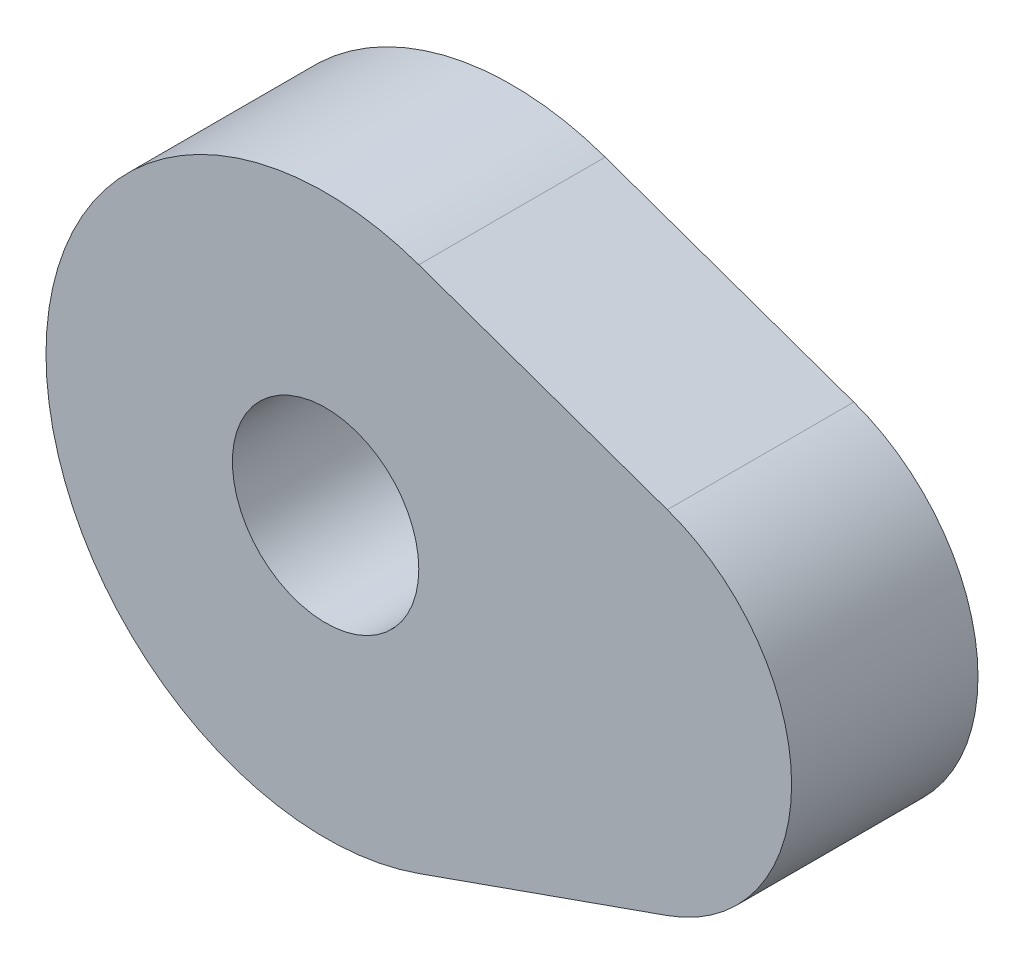
from build123d import *

# Parameters (mm, degrees)
EXTRUDE_1_DEPTH     = 10
SKETCH_3_R          = 5
CUT_EXTRUDE_1_DEPTH = 31.822070015


with BuildPart() as part:
    # 草图1 → 凸台-拉伸1 (new body)
    with BuildSketch(Plane.XY):
        with BuildLine():
            Line((5, 14.142135624), (18.333333333, 9.428090416))
            ThreePointArc((18.333333333, 9.428090416), (25, 0), (18.333333333, -9.428090416))
            Line((18.333333333, -9.428090416), (5, -14.142135624))
            ThreePointArc((5, -14.142135624), (-15, 0), (5, 14.142135624))
        make_face()
    extrude(amount=EXTRUDE_1_DEPTH)

    # 草图3 → 切除-拉伸1 (cut, through all)
    with BuildSketch(Plane.XY.offset(10)):
        Circle(SKETCH_3_R)
    extrude(amount=-CUT_EXTRUDE_1_DEPTH, mode=Mode.SUBTRACT)


solid = part.part
